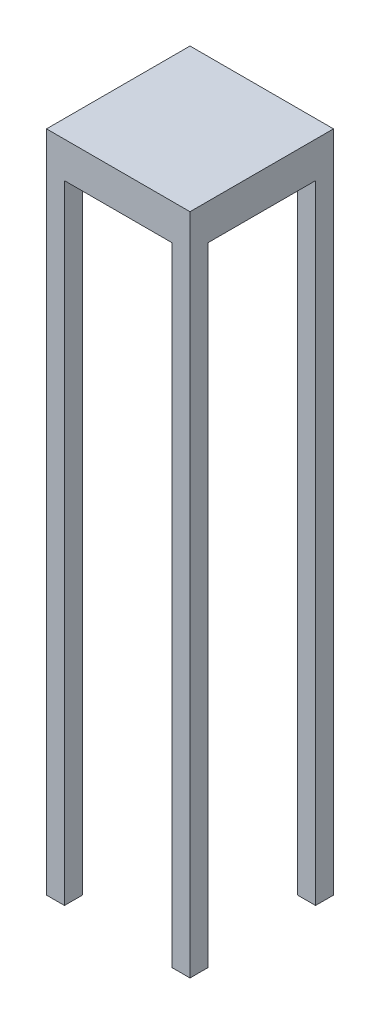
from build123d import *

# Parameters (mm, degrees)
CROQUIS1_W              = 200
CROQUIS1_H              = 200
SALIENTE_EXTRUIR1_DEPTH = 50
CROQUIS2_W              = 25
CROQUIS2_H              = 25
SALIENTE_EXTRUIR2_DEPTH = 875


with BuildPart() as part:
    # Croquis1 → Saliente-Extruir1 (new body)
    with BuildSketch(Plane(origin=(0, 0, 0), x_dir=(1, 0, 0), z_dir=(0, 1, 0))):
        with Locations((100, 100)):
            Rectangle(CROQUIS1_W, CROQUIS1_H)
    extrude(amount=SALIENTE_EXTRUIR1_DEPTH)

    # Croquis2 → Saliente-Extruir2 (add)
    with BuildSketch(Plane.XZ):
        with Locations((12.5, -12.5)):
            Rectangle(CROQUIS2_W, CROQUIS2_H)
        with Locations((187.5, -12.5)):
            Rectangle(CROQUIS2_W, CROQUIS2_H)
        with Locations((12.5, -187.5)):
            Rectangle(CROQUIS2_W, CROQUIS2_H)
        with Locations((187.5, -187.5)):
            Rectangle(CROQUIS2_W, CROQUIS2_H)
    extrude(amount=SALIENTE_EXTRUIR2_DEPTH)


solid = part.part
